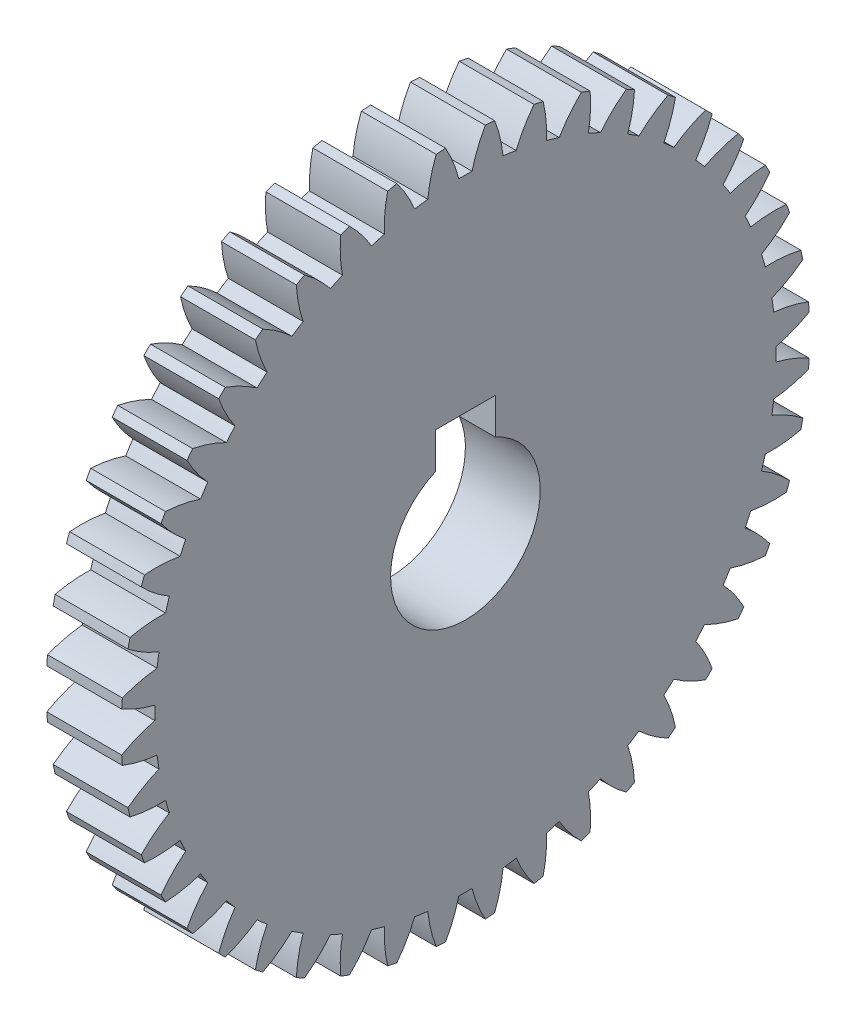
from build123d import *

# Parameters (mm, degrees)
CROQUIS1_R              = 5
SALIENTE_EXTRUIR1_DEPTH = 5
CORTAR_EXTRUIR1_DEPTH   = 33.855235811


with BuildPart() as part:
    # Croquis1 → Saliente-Extruir1 (new body)
    with BuildSketch(Plane(origin=(5, 0, 0), x_dir=(0, 0, -1), z_dir=(1, 0, 0))):
        with BuildLine():
            ThreePointArc((3.391404779, 20.469962741), (2.952890579, 20.537805098), (2.513025884, 20.59625456))
            ThreePointArc((2.513025884, 20.59625456), (2.311641624, 21.775742704), (1.952112306, 22.917008041))
            ThreePointArc((1.952112306, 22.917008041), (1.640801214, 22.941398636), (1.329187675, 22.961560489))
            ThreePointArc((1.329187675, 22.961560489), (0.810898855, 21.883077945), (0.443705732, 20.744255258))
            ThreePointArc((0.443705732, 20.744255258), (0, 20.749), (-0.443705733, 20.744255258))
            ThreePointArc((-0.443705733, 20.744255258), (-0.810898855, 21.883077945), (-1.329187675, 22.961560489))
            ThreePointArc((-1.329187675, 22.961560489), (-1.640801213, 22.941398636), (-1.952112306, 22.917008041))
            ThreePointArc((-1.952112306, 22.917008041), (-2.311641624, 21.775742704), (-2.513025884, 20.59625456))
            ThreePointArc((-2.513025884, 20.59625456), (-2.952890579, 20.537805098), (-3.39140478, 20.469962741))
            ThreePointArc((-3.39140478, 20.469962741), (-3.916931772, 21.544936825), (-4.583429228, 22.538681783))
            ThreePointArc((-4.583429228, 22.538681783), (-4.889001659, 22.474377917), (-5.19367291, 22.405931395))
            ThreePointArc((-5.19367291, 22.405931395), (-5.387123748, 21.225116137), (-5.418599543, 20.028973513))
            ThreePointArc((-5.418599543, 20.028973513), (-5.845668823, 19.908519709), (-6.270064607, 19.778960813))
            ThreePointArc((-6.270064607, 19.778960813), (-6.943227254, 20.768202921), (-7.74436538, 21.656980511))
            ThreePointArc((-7.74436538, 21.656980511), (-8.037676128, 21.549843676), (-8.329505307, 21.438734602))
            ThreePointArc((-8.329505307, 21.438734602), (-8.352939564, 20.242407415), (-8.213866138, 19.053960325))
            ThreePointArc((-8.213866138, 19.053960325), (-8.619446106, 18.873954271), (-9.021083999, 18.68531628))
            ThreePointArc((-9.021083999, 18.68531628), (-9.828178653, 19.568688297), (-10.747648588, 20.334405568))
            ThreePointArc((-10.747648588, 20.334405568), (-11.022726695, 20.18661676), (-11.295773005, 20.035106993))
            ThreePointArc((-11.295773005, 20.035106993), (-11.148713622, 18.84762165), (-10.841922105, 17.691063452))
            ThreePointArc((-10.841922105, 17.691063452), (-11.217756322, 17.455169553), (-11.588460136, 17.211292592))
            ThreePointArc((-11.588460136, 17.211292592), (-12.513056676, 17.97081161), (-13.532140662, 18.597880769))
            ThreePointArc((-13.532140662, 18.597880769), (-13.78338633, 18.412448541), (-14.032091334, 18.223622383))
            ThreePointArc((-14.032091334, 18.223622383), (-13.717532019, 17.069152662), (-13.249267805, 15.968027543))
            ThreePointArc((-13.249267805, 15.968027543), (-13.587705369, 15.681047918), (-13.919928642, 15.38689662))
            ThreePointArc((-13.919928642, 15.38689662), (-14.943204949, 16.007101023), (-16.041157375, 16.482756749))
            ThreePointArc((-16.041157375, 16.482756749), (-16.263455967, 16.263455967), (-16.482756749, 16.041157375))
            ThreePointArc((-16.482756749, 16.041157375), (-16.007101023, 14.943204949), (-15.38689662, 13.919928642))
            ThreePointArc((-15.38689662, 13.919928642), (-15.681047918, 13.587705369), (-15.968027543, 13.249267805))
            ThreePointArc((-15.968027543, 13.249267805), (-17.069152662, 13.717532019), (-18.223622383, 14.032091335))
            ThreePointArc((-18.223622383, 14.032091335), (-18.412448541, 13.78338633), (-18.597880769, 13.532140662))
            ThreePointArc((-18.597880769, 13.532140662), (-17.97081161, 12.513056676), (-17.211292592, 11.588460136))
            ThreePointArc((-17.211292592, 11.588460136), (-17.455169553, 11.217756322), (-17.691063452, 10.841922105))
            ThreePointArc((-17.691063452, 10.841922105), (-18.84762165, 11.148713622), (-20.035106993, 11.295773005))
            ThreePointArc((-20.035106993, 11.295773005), (-20.18661676, 11.022726695), (-20.334405568, 10.747648588))
            ThreePointArc((-20.334405568, 10.747648588), (-19.568688297, 9.828178653), (-18.68531628, 9.021083999))
            ThreePointArc((-18.68531628, 9.021083999), (-18.873954271, 8.619446105), (-19.053960325, 8.213866138))
            ThreePointArc((-19.053960325, 8.213866138), (-20.242407414, 8.352939566), (-21.4387346, 8.329505312))
            ThreePointArc((-21.4387346, 8.329505312), (-21.549843675, 8.03767613), (-21.656980511, 7.74436538))
            ThreePointArc((-21.656980511, 7.74436538), (-20.768202921, 6.943227254), (-19.778960813, 6.270064607))
            ThreePointArc((-19.778960813, 6.270064607), (-19.90851971, 5.845668822), (-20.028973514, 5.418599541))
            ThreePointArc((-20.028973514, 5.418599541), (-21.225116137, 5.387123747), (-22.405931395, 5.19367291))
            ThreePointArc((-22.405931395, 5.19367291), (-22.474377917, 4.889001659), (-22.538681783, 4.583429228))
            ThreePointArc((-22.538681783, 4.583429228), (-21.544936825, 3.916931772), (-20.469962741, 3.39140478))
            ThreePointArc((-20.469962741, 3.39140478), (-20.537805098, 2.952890579), (-20.59625456, 2.513025884))
            ThreePointArc((-20.59625456, 2.513025884), (-21.775742704, 2.311641625), (-22.917008041, 1.952112306))
            ThreePointArc((-22.917008041, 1.952112306), (-22.941398636, 1.640801213), (-22.961560489, 1.329187675))
            ThreePointArc((-22.961560489, 1.329187675), (-21.883077945, 0.810898855), (-20.744255258, 0.443705733))
            ThreePointArc((-20.744255258, 0.443705733), (-20.749, 0), (-20.744255258, -0.443705732))
            ThreePointArc((-20.744255258, -0.443705732), (-21.883077945, -0.810898854), (-22.961560489, -1.329187675))
            ThreePointArc((-22.961560489, -1.329187675), (-22.941398636, -1.640801213), (-22.917008041, -1.952112306))
            ThreePointArc((-22.917008041, -1.952112306), (-21.775742704, -2.311641624), (-20.59625456, -2.513025884))
            ThreePointArc((-20.59625456, -2.513025884), (-20.537805098, -2.952890579), (-20.469962741, -3.39140478))
            ThreePointArc((-20.469962741, -3.39140478), (-21.544936825, -3.916931772), (-22.538681783, -4.583429228))
            ThreePointArc((-22.538681783, -4.583429228), (-22.474377917, -4.889001659), (-22.405931395, -5.193672911))
            ThreePointArc((-22.405931395, -5.193672911), (-21.225116137, -5.387123747), (-20.028973514, -5.41859954))
            ThreePointArc((-20.028973514, -5.41859954), (-19.90851971, -5.845668822), (-19.778960813, -6.270064607))
            ThreePointArc((-19.778960813, -6.270064607), (-20.768202921, -6.943227255), (-21.656980511, -7.74436538))
            ThreePointArc((-21.656980511, -7.74436538), (-21.549843675, -8.037676131), (-21.4387346, -8.329505312))
            ThreePointArc((-21.4387346, -8.329505312), (-20.242407414, -8.352939566), (-19.053960325, -8.213866138))
            ThreePointArc((-19.053960325, -8.213866138), (-18.873954271, -8.619446105), (-18.68531628, -9.021083999))
            ThreePointArc((-18.68531628, -9.021083999), (-19.568688297, -9.828178653), (-20.334405569, -10.747648586))
            ThreePointArc((-20.334405569, -10.747648586), (-20.18661676, -11.022726694), (-20.035106993, -11.295773005))
            ThreePointArc((-20.035106993, -11.295773005), (-18.84762165, -11.148713622), (-17.691063452, -10.841922105))
            ThreePointArc((-17.691063452, -10.841922105), (-17.455169553, -11.217756322), (-17.211292592, -11.588460136))
            ThreePointArc((-17.211292592, -11.588460136), (-17.97081161, -12.513056675), (-18.59788077, -13.53214066))
            ThreePointArc((-18.59788077, -13.53214066), (-18.412448541, -13.783386329), (-18.223622383, -14.032091335))
            ThreePointArc((-18.223622383, -14.032091335), (-17.069152662, -13.71753202), (-15.968027543, -13.249267806))
            ThreePointArc((-15.968027543, -13.249267806), (-15.681047918, -13.587705369), (-15.38689662, -13.919928642))
            ThreePointArc((-15.38689662, -13.919928642), (-16.007101023, -14.943204948), (-16.48275675, -16.041157374))
            ThreePointArc((-16.48275675, -16.041157374), (-16.263455968, -16.263455967), (-16.041157375, -16.48275675))
            ThreePointArc((-16.041157375, -16.48275675), (-14.943204948, -16.007101023), (-13.919928642, -15.38689662))
            ThreePointArc((-13.919928642, -15.38689662), (-13.587705369, -15.681047918), (-13.249267805, -15.968027543))
            ThreePointArc((-13.249267805, -15.968027543), (-13.717532019, -17.069152662), (-14.032091334, -18.223622383))
            ThreePointArc((-14.032091334, -18.223622383), (-13.78338633, -18.412448541), (-13.532140661, -18.597880769))
            ThreePointArc((-13.532140661, -18.597880769), (-12.513056676, -17.97081161), (-11.588460136, -17.211292592))
            ThreePointArc((-11.588460136, -17.211292592), (-11.217756321, -17.455169553), (-10.841922105, -17.691063452))
            ThreePointArc((-10.841922105, -17.691063452), (-11.148713621, -18.847621651), (-11.295773004, -20.035106993))
            ThreePointArc((-11.295773004, -20.035106993), (-11.022726694, -20.18661676), (-10.747648587, -20.334405569))
            ThreePointArc((-10.747648587, -20.334405569), (-9.828178653, -19.568688297), (-9.021083999, -18.68531628))
            ThreePointArc((-9.021083999, -18.68531628), (-8.619446105, -18.873954272), (-8.213866137, -19.053960326))
            ThreePointArc((-8.213866137, -19.053960326), (-8.352939567, -20.242407413), (-8.329505316, -21.438734598))
            ThreePointArc((-8.329505316, -21.438734598), (-8.037676133, -21.549843674), (-7.744365382, -21.65698051))
            ThreePointArc((-7.744365382, -21.65698051), (-6.943227255, -20.768202921), (-6.270064606, -19.778960813))
            ThreePointArc((-6.270064606, -19.778960813), (-5.845668822, -19.90851971), (-5.418599541, -20.028973514))
            ThreePointArc((-5.418599541, -20.028973514), (-5.387123747, -21.225116137), (-5.19367291, -22.405931395))
            ThreePointArc((-5.19367291, -22.405931395), (-4.889001659, -22.474377917), (-4.583429229, -22.538681782))
            ThreePointArc((-4.583429229, -22.538681782), (-3.916931773, -21.544936825), (-3.39140478, -20.469962741))
            ThreePointArc((-3.39140478, -20.469962741), (-2.952890579, -20.537805098), (-2.513025884, -20.59625456))
            ThreePointArc((-2.513025884, -20.59625456), (-2.311641624, -21.775742704), (-1.952112305, -22.917008041))
            ThreePointArc((-1.952112305, -22.917008041), (-1.640801212, -22.941398636), (-1.329187674, -22.96156049))
            ThreePointArc((-1.329187674, -22.96156049), (-0.810898854, -21.883077945), (-0.443705732, -20.744255258))
            ThreePointArc((-0.443705732, -20.744255258), (0, -20.749), (0.443705732, -20.744255258))
            ThreePointArc((0.443705732, -20.744255258), (0.810898855, -21.883077945), (1.329187676, -22.961560489))
            ThreePointArc((1.329187676, -22.961560489), (1.640801214, -22.941398636), (1.952112307, -22.917008041))
            ThreePointArc((1.952112307, -22.917008041), (2.311641625, -21.775742704), (2.513025884, -20.59625456))
            ThreePointArc((2.513025884, -20.59625456), (2.952890579, -20.537805098), (3.39140478, -20.469962741))
            ThreePointArc((3.39140478, -20.469962741), (3.916931772, -21.544936825), (4.583429229, -22.538681782))
            ThreePointArc((4.583429229, -22.538681782), (4.88900166, -22.474377917), (5.193672911, -22.405931395))
            ThreePointArc((5.193672911, -22.405931395), (5.387123747, -21.225116137), (5.418599541, -20.028973514))
            ThreePointArc((5.418599541, -20.028973514), (5.845668822, -19.90851971), (6.270064606, -19.778960813))
            ThreePointArc((6.270064606, -19.778960813), (6.943227255, -20.768202921), (7.744365381, -21.65698051))
            ThreePointArc((7.744365381, -21.65698051), (8.037676131, -21.549843675), (8.329505313, -21.4387346))
            ThreePointArc((8.329505313, -21.4387346), (8.352939566, -20.242407414), (8.213866137, -19.053960325))
            ThreePointArc((8.213866137, -19.053960325), (8.619446105, -18.873954272), (9.021083999, -18.68531628))
            ThreePointArc((9.021083999, -18.68531628), (9.828178653, -19.568688297), (10.747648587, -20.334405569))
            ThreePointArc((10.747648587, -20.334405569), (11.022726695, -20.18661676), (11.295773005, -20.035106992))
            ThreePointArc((11.295773005, -20.035106992), (11.148713622, -18.84762165), (10.841922105, -17.691063452))
            ThreePointArc((10.841922105, -17.691063452), (11.217756321, -17.455169553), (11.588460135, -17.211292592))
            ThreePointArc((11.588460135, -17.211292592), (12.513056675, -17.97081161), (13.532140661, -18.597880769))
            ThreePointArc((13.532140661, -18.597880769), (13.78338633, -18.412448541), (14.032091335, -18.223622383))
            ThreePointArc((14.032091335, -18.223622383), (13.717532019, -17.069152662), (13.249267805, -15.968027544))
            ThreePointArc((13.249267805, -15.968027544), (13.587705368, -15.681047919), (13.919928642, -15.386896621))
            ThreePointArc((13.919928642, -15.386896621), (14.943204948, -16.007101023), (16.041157374, -16.48275675))
            ThreePointArc((16.041157374, -16.48275675), (16.263455967, -16.263455967), (16.48275675, -16.041157374))
            ThreePointArc((16.48275675, -16.041157374), (16.007101023, -14.943204948), (15.386896621, -13.919928642))
            ThreePointArc((15.386896621, -13.919928642), (15.681047919, -13.587705368), (15.968027544, -13.249267805))
            ThreePointArc((15.968027544, -13.249267805), (17.069152662, -13.717532019), (18.223622383, -14.032091335))
            ThreePointArc((18.223622383, -14.032091335), (18.412448541, -13.78338633), (18.597880769, -13.532140661))
            ThreePointArc((18.597880769, -13.532140661), (17.97081161, -12.513056675), (17.211292592, -11.588460135))
            ThreePointArc((17.211292592, -11.588460135), (17.455169553, -11.217756321), (17.691063452, -10.841922105))
            ThreePointArc((17.691063452, -10.841922105), (18.84762165, -11.148713622), (20.035106992, -11.295773005))
            ThreePointArc((20.035106992, -11.295773005), (20.18661676, -11.022726695), (20.334405569, -10.747648587))
            ThreePointArc((20.334405569, -10.747648587), (19.568688297, -9.828178653), (18.68531628, -9.021083999))
            ThreePointArc((18.68531628, -9.021083999), (18.873954272, -8.619446105), (19.053960325, -8.213866137))
            ThreePointArc((19.053960325, -8.213866137), (20.242407414, -8.352939566), (21.4387346, -8.329505313))
            ThreePointArc((21.4387346, -8.329505313), (21.549843675, -8.037676131), (21.65698051, -7.744365381))
            ThreePointArc((21.65698051, -7.744365381), (20.768202921, -6.943227255), (19.778960813, -6.270064606))
            ThreePointArc((19.778960813, -6.270064606), (19.90851971, -5.845668822), (20.028973514, -5.418599541))
            ThreePointArc((20.028973514, -5.418599541), (21.225116137, -5.387123747), (22.405931395, -5.193672911))
            ThreePointArc((22.405931395, -5.193672911), (22.474377917, -4.88900166), (22.538681782, -4.583429229))
            ThreePointArc((22.538681782, -4.583429229), (21.544936825, -3.916931772), (20.469962741, -3.39140478))
            ThreePointArc((20.469962741, -3.39140478), (20.537805098, -2.952890579), (20.59625456, -2.513025884))
            ThreePointArc((20.59625456, -2.513025884), (21.775742704, -2.311641625), (22.917008041, -1.952112307))
            ThreePointArc((22.917008041, -1.952112307), (22.941398636, -1.640801214), (22.961560489, -1.329187676))
            ThreePointArc((22.961560489, -1.329187676), (21.883077945, -0.810898855), (20.744255258, -0.443705732))
            ThreePointArc((20.744255258, -0.443705732), (20.749, 0), (20.744255258, 0.443705732))
            ThreePointArc((20.744255258, 0.443705732), (21.883077945, 0.810898855), (22.961560489, 1.329187676))
            ThreePointArc((22.961560489, 1.329187676), (22.941398636, 1.640801213), (22.917008041, 1.952112305))
            ThreePointArc((22.917008041, 1.952112305), (21.775742704, 2.311641624), (20.59625456, 2.513025884))
            ThreePointArc((20.59625456, 2.513025884), (20.537805098, 2.952890579), (20.469962741, 3.39140478))
            ThreePointArc((20.469962741, 3.39140478), (21.544936825, 3.916931773), (22.538681782, 4.583429229))
            ThreePointArc((22.538681782, 4.583429229), (22.474377917, 4.889001659), (22.405931395, 5.19367291))
            ThreePointArc((22.405931395, 5.19367291), (21.225116137, 5.387123747), (20.028973514, 5.418599541))
            ThreePointArc((20.028973514, 5.418599541), (19.90851971, 5.845668822), (19.778960813, 6.270064606))
            ThreePointArc((19.778960813, 6.270064606), (20.768202921, 6.943227255), (21.65698051, 7.744365382))
            ThreePointArc((21.65698051, 7.744365382), (21.549843674, 8.037676132), (21.438734599, 8.329505313))
            ThreePointArc((21.438734599, 8.329505313), (20.242407414, 8.352939566), (19.053960325, 8.213866137))
            ThreePointArc((19.053960325, 8.213866137), (18.873954272, 8.619446105), (18.68531628, 9.021083999))
            ThreePointArc((18.68531628, 9.021083999), (19.568688297, 9.828178653), (20.334405569, 10.747648587))
            ThreePointArc((20.334405569, 10.747648587), (20.186616759, 11.022726695), (20.035106992, 11.295773006))
            ThreePointArc((20.035106992, 11.295773006), (18.84762165, 11.148713622), (17.691063452, 10.841922105))
            ThreePointArc((17.691063452, 10.841922105), (17.455169553, 11.217756321), (17.211292592, 11.588460136))
            ThreePointArc((17.211292592, 11.588460136), (17.97081161, 12.513056676), (18.597880769, 13.532140661))
            ThreePointArc((18.597880769, 13.532140661), (18.412448541, 13.78338633), (18.223622383, 14.032091335))
            ThreePointArc((18.223622383, 14.032091335), (17.069152661, 13.71753202), (15.968027544, 13.249267805))
            ThreePointArc((15.968027544, 13.249267805), (15.681047918, 13.587705369), (15.38689662, 13.919928642))
            ThreePointArc((15.38689662, 13.919928642), (16.007101023, 14.943204948), (16.48275675, 16.041157375))
            ThreePointArc((16.48275675, 16.041157375), (16.263455967, 16.263455967), (16.041157374, 16.48275675))
            ThreePointArc((16.041157374, 16.48275675), (14.943204948, 16.007101023), (13.919928642, 15.38689662))
            ThreePointArc((13.919928642, 15.38689662), (13.587705369, 15.681047918), (13.249267806, 15.968027543))
            ThreePointArc((13.249267806, 15.968027543), (13.71753202, 17.069152662), (14.032091335, 18.223622383))
            ThreePointArc((14.032091335, 18.223622383), (13.78338633, 18.412448541), (13.532140661, 18.59788077))
            ThreePointArc((13.532140661, 18.59788077), (12.513056675, 17.97081161), (11.588460136, 17.211292592))
            ThreePointArc((11.588460136, 17.211292592), (11.217756322, 17.455169553), (10.841922106, 17.691063452))
            ThreePointArc((10.841922106, 17.691063452), (11.148713622, 18.84762165), (11.295773005, 20.035106993))
            ThreePointArc((11.295773005, 20.035106993), (11.022726694, 20.18661676), (10.747648587, 20.334405569))
            ThreePointArc((10.747648587, 20.334405569), (9.828178653, 19.568688297), (9.021083999, 18.68531628))
            ThreePointArc((9.021083999, 18.68531628), (8.619446106, 18.873954271), (8.213866138, 19.053960325))
            ThreePointArc((8.213866138, 19.053960325), (8.352939566, 20.242407414), (8.329505312, 21.4387346))
            ThreePointArc((8.329505312, 21.4387346), (8.037676131, 21.549843675), (7.744365381, 21.656980511))
            ThreePointArc((7.744365381, 21.656980511), (6.943227254, 20.768202921), (6.270064606, 19.778960813))
            ThreePointArc((6.270064606, 19.778960813), (5.845668822, 19.90851971), (5.418599541, 20.028973514))
            ThreePointArc((5.418599541, 20.028973514), (5.387123747, 21.225116137), (5.193672911, 22.405931395))
            ThreePointArc((5.193672911, 22.405931395), (4.88900166, 22.474377917), (4.583429229, 22.538681783))
            ThreePointArc((4.583429229, 22.538681783), (3.916931772, 21.544936825), (3.391404779, 20.469962741))
        make_face()
        with Locations(Location((0, 0, 0), (0, 0, 180))):
            Circle(CROQUIS1_R, mode=Mode.SUBTRACT)
    extrude(amount=-SALIENTE_EXTRUIR1_DEPTH)

    # Croquis2 → Cortar-Extruir1 (cut, through all)
    with BuildSketch(Plane.ZY):
        with BuildLine():
            Line((-2, 7), (2, 7))
            Line((2, 7), (2, 4.582575695))
            ThreePointArc((2, 4.582575695), (0, 5), (-2, 4.582575695))
            Line((-2, 4.582575695), (-2, 7))
        make_face()
    extrude(amount=-CORTAR_EXTRUIR1_DEPTH, mode=Mode.SUBTRACT)


solid = part.part
